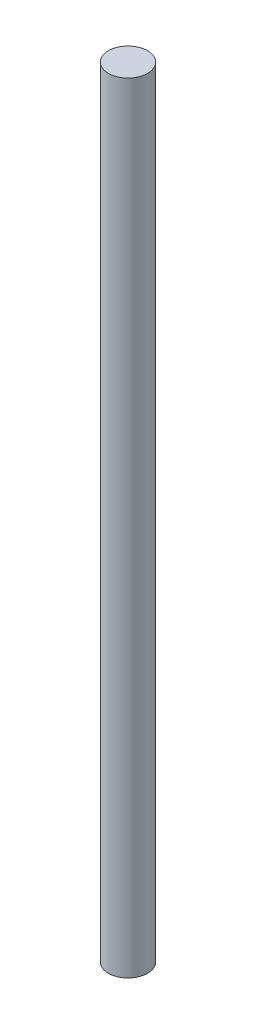
from build123d import *

# Parameters (mm, degrees)
SKETCH_1_R      = 2.015
EXTRUDE_1_DEPTH = 80


with BuildPart() as part:
    # 草图1 → 凸台-拉伸1 (new body)
    with BuildSketch(Plane(origin=(0, 0, 0), x_dir=(1, 0, 0), z_dir=(0, 1, 0))):
        with Locations(Location((0, 0, 0), (0, 0, 270))):
            Circle(SKETCH_1_R)
    extrude(amount=EXTRUDE_1_DEPTH)


solid = part.part
